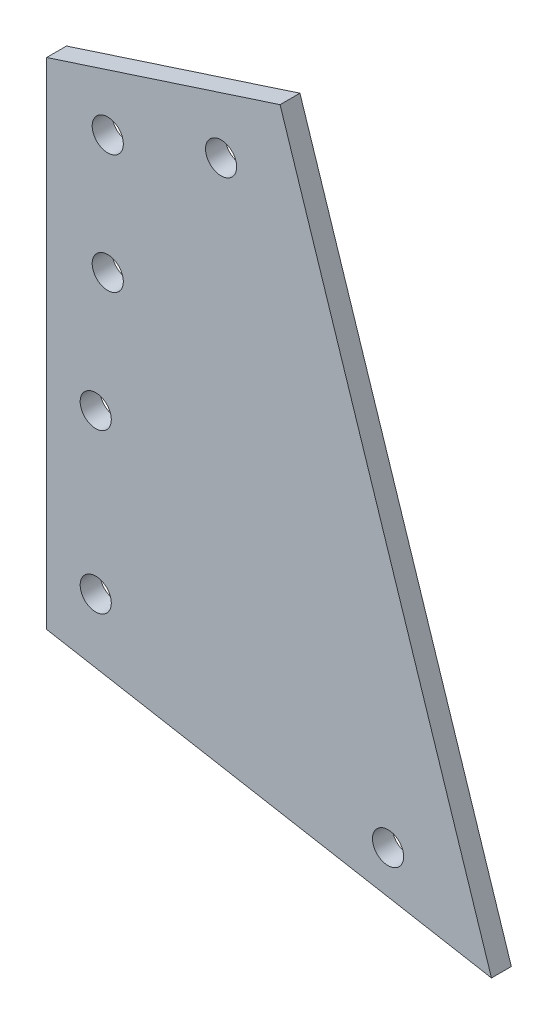
from build123d import *

# Parameters (mm, degrees)
BOSS_EXTRUDE1_DEPTH    = 3.175
F_10_CLEARANCE_HOLE1_D = 4.9784


with BuildPart() as part:
    # Sketch2 → Boss-Extrude1 (new body)
    with BuildSketch(Plane.XY):
        Polygon((75.96605069, 191.201454104), (42.169306363, 295.217137729), (4.854209552, 283.092727808), (4.854209552, 203.901454104), align=None)
    extrude(amount=BOSS_EXTRUDE1_DEPTH)

    # #10 Clearance Hole1 (through all)
    with Locations(Plane.XY.offset(3.175)):
        with Locations((32.740251946, 283.138719963), (59.435154755, 200.980257064), (12.7, 238.125), (12.7, 212.725), (14.622625311, 277.25194622), (14.622625311, 258.20194622)):
            Hole(F_10_CLEARANCE_HOLE1_D / 2)


solid = part.part
